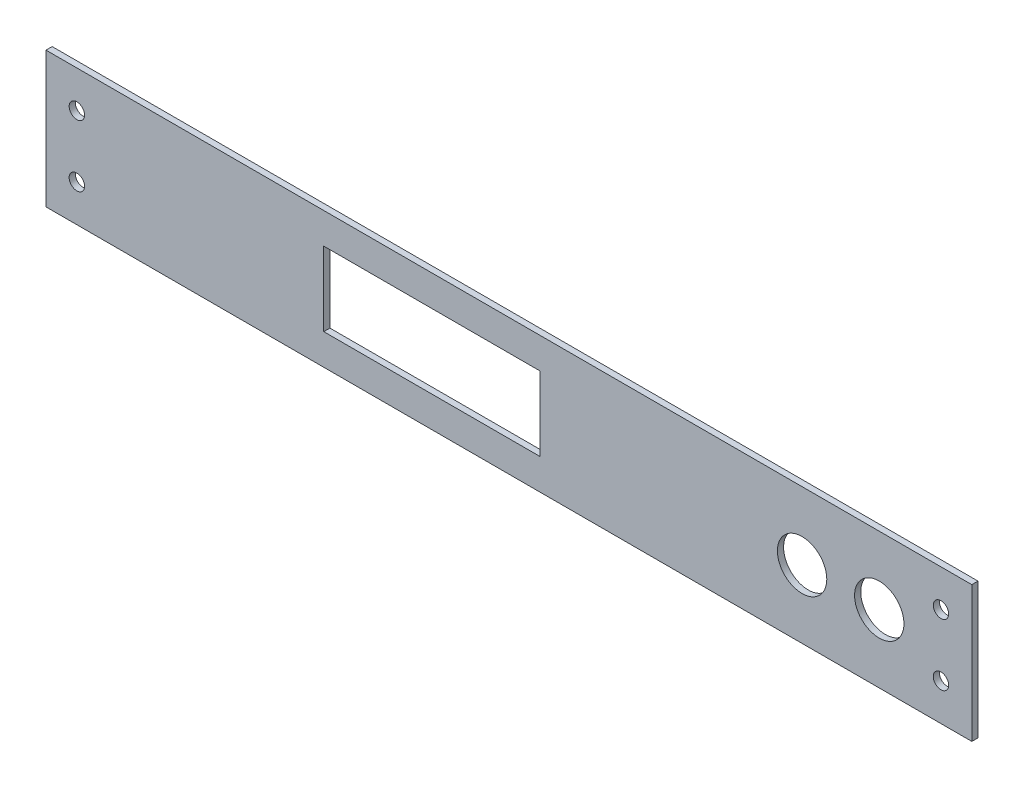
from build123d import *

# Parameters (mm, degrees)
ESBO_O1_W                = 300
ESBO_O1_H                = 44
ESBO_O1_R                = 2.5
ESBO_O1_R_2              = 8
ESBO_O1_W_2              = 70
ESBO_O1_H_2              = 24
RESSALTO_EXTRUS_O1_DEPTH = 2


with BuildPart() as part:
    # Esboço1 → Ressalto-extrusão1 (new body)
    with BuildSketch(Plane.XY):
        with Locations((85.905203177, 0.633475128)):
            Rectangle(ESBO_O1_W, ESBO_O1_H)
        with Locations((-54.094796823, 10.633475128)):
            Circle(ESBO_O1_R, mode=Mode.SUBTRACT)
        with Locations((-54.094796823, -9.366524872)):
            Circle(ESBO_O1_R, mode=Mode.SUBTRACT)
        with Locations((225.905203177, 10.633475128)):
            Circle(ESBO_O1_R, mode=Mode.SUBTRACT)
        with Locations((225.905203177, -9.366524872)):
            Circle(ESBO_O1_R, mode=Mode.SUBTRACT)
        with Locations((205.905203177, 0.633475128)):
            Circle(ESBO_O1_R_2, mode=Mode.SUBTRACT)
        with Locations((180.905203177, 0.633475128)):
            Circle(ESBO_O1_R_2, mode=Mode.SUBTRACT)
        with Locations((60.905203177, 0.633475128)):
            Rectangle(ESBO_O1_W_2, ESBO_O1_H_2, mode=Mode.SUBTRACT)
    extrude(amount=RESSALTO_EXTRUS_O1_DEPTH)


solid = part.part
